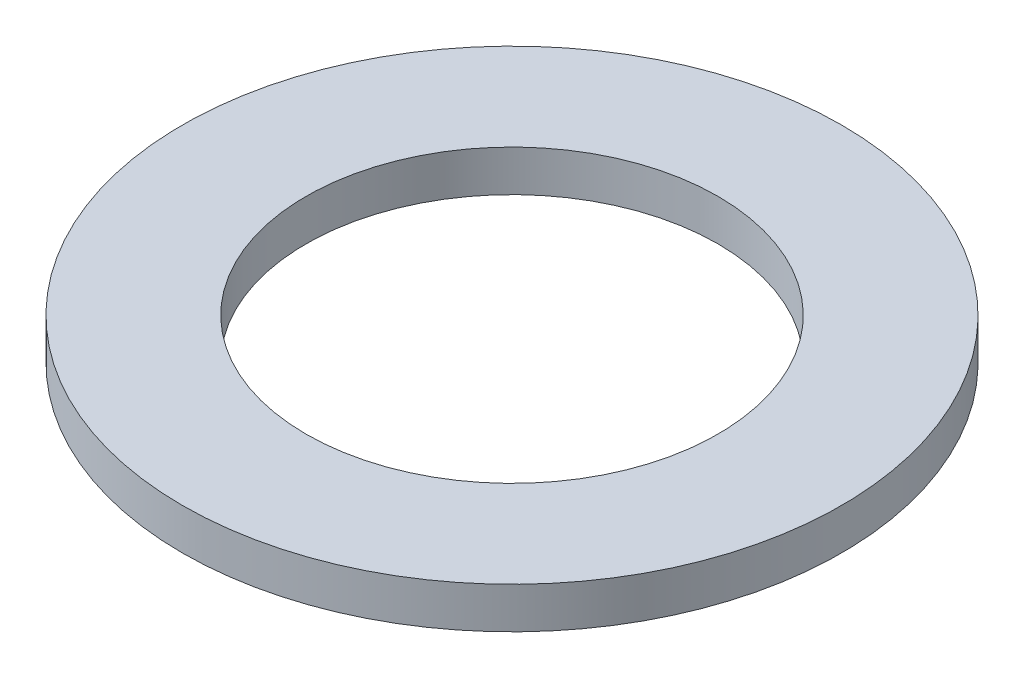
from build123d import *

# Parameters (mm, degrees)
SKETCH1_R           = 8
BOSS_EXTRUDE1_DEPTH = 1
SKETCH5_R           = 5
CUT_EXTRUDE1_DEPTH  = 12.357816692


with BuildPart() as part:
    # Sketch1 → Boss-Extrude1 (new body)
    with BuildSketch(Plane(origin=(0, 0, 0), x_dir=(1, 0, 0), z_dir=(0, 1, 0))):
        with Locations(Location((0, 0, 0), (0, 0, 270))):
            Circle(SKETCH1_R)
    extrude(amount=BOSS_EXTRUDE1_DEPTH)

    # Sketch5 → Cut-Extrude1 (cut, through all)
    with BuildSketch(Plane(origin=(0, 1, 0), x_dir=(-1, 0, 0), z_dir=(0, 1, 0))):
        with Locations(Location((0, 0, 0), (0, 0, 90))):
            Circle(SKETCH5_R)
    extrude(amount=-CUT_EXTRUDE1_DEPTH, mode=Mode.SUBTRACT)


solid = part.part
